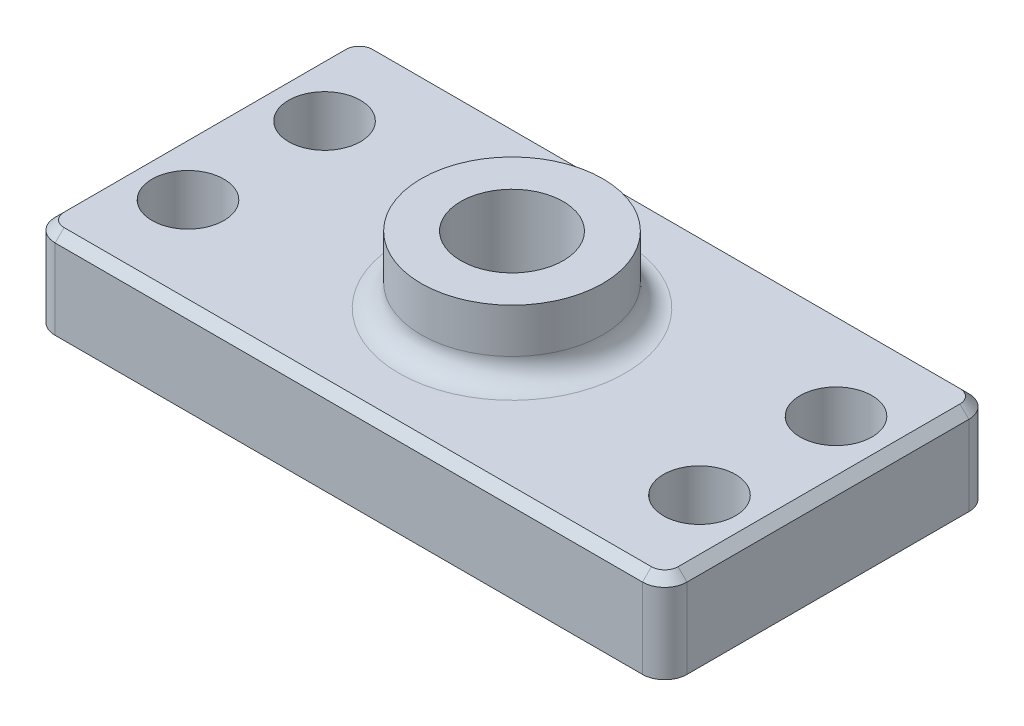
from build123d import *

# Parameters (mm, degrees)
SKETCH1_W           = 180.535384616
SKETCH1_H           = 93.243550296
SKETCH1_R           = 10.271487678
BOSS_EXTRUDE1_DEPTH = 25.4
SKETCH2_R           = 25.944815363
BOSS_EXTRUDE2_DEPTH = 19.05
SKETCH3_R           = 14.648002934
CUT_EXTRUDE1_DEPTH  = 111.894764045
FILLET2_R           = 6.35
CHAMFER1_SIZE       = 2.54


with BuildPart() as part:
    # Sketch1 → Boss-Extrude1 (new body)
    with BuildSketch(Plane(origin=(0, 0, 0), x_dir=(1, 0, 0), z_dir=(0, 1, 0))):
        Rectangle(SKETCH1_W, SKETCH1_H)
        with Locations(Location((73.073846154, 19.508402367, 0), (0, 0, 270))):
            Circle(SKETCH1_R, mode=Mode.SUBTRACT)
        with Locations(Location((-73.073846154, 19.508402367, 0), (0, 0, 270))):
            Circle(SKETCH1_R, mode=Mode.SUBTRACT)
        with Locations(Location((73.073846154, -19.508402367, 0), (0, 0, 270))):
            Circle(SKETCH1_R, mode=Mode.SUBTRACT)
        with Locations(Location((-73.073846154, -19.508402367, 0), (0, 0, 270))):
            Circle(SKETCH1_R, mode=Mode.SUBTRACT)
    extrude(amount=BOSS_EXTRUDE1_DEPTH)

    # Sketch2 → Boss-Extrude2 (add)
    with BuildSketch(Plane(origin=(0, 25.4, 0), x_dir=(1, 0, 0), z_dir=(0, 1, 0))):
        with Locations(Location((0, 0, 0), (0, 0, 90))):
            Circle(SKETCH2_R)
    extrude(amount=BOSS_EXTRUDE2_DEPTH)

    # Sketch3 → Cut-Extrude1 (cut, through all)
    with BuildSketch(Plane(origin=(0, 44.45, 0), x_dir=(1, 0, 0), z_dir=(0, 1, 0))):
        with Locations(Location((0, 0, 0), (0, 0, 270))):
            Circle(SKETCH3_R)
    extrude(amount=-CUT_EXTRUDE1_DEPTH, mode=Mode.SUBTRACT)

    # Fillet2
    fillet2_edges = [part.edges().sort_by_distance(p)[0] for p in [
        (-90.267692308, 12.7, 46.621775148),
        (-90.267692308, 12.7, -46.621775148),
        (90.267692308, 12.7, -46.621775148),
        (90.267692308, 12.7, 46.621775148),
        (0, 25.4, 25.944815363),
    ]]
    fillet(fillet2_edges, radius=FILLET2_R)

    # Chamfer1
    chamfer1_edges = [part.edges().sort_by_distance(p)[0] for p in [
        (-90.267692308, 25.4, 0),
        (0, 25.4, -46.621775148),
        (0, 25.4, 46.621775148),
        (90.267692308, 25.4, 0),
        (-88.407820368, 25.4, 44.761903208),
        (88.407820368, 25.4, 44.761903208),
        (88.407820368, 25.4, -44.761903208),
        (-88.407820368, 25.4, -44.761903208),
    ]]
    chamfer(chamfer1_edges, length=CHAMFER1_SIZE)


solid = part.part
